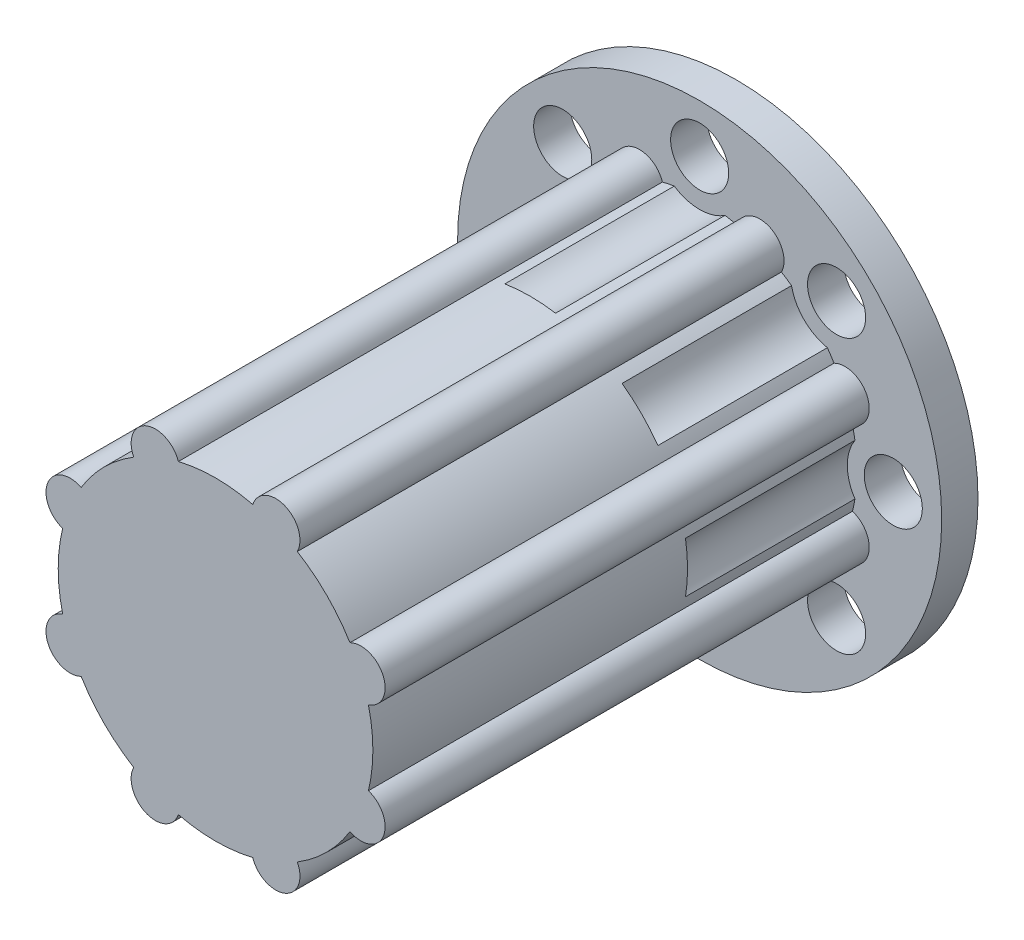
from build123d import *

# Parameters (mm, degrees)
CROQUIS1_R              = 10
CROQUIS1_R_2            = 5
SALIENTE_EXTRUIR1_DEPTH = 1.5
CORTAR_EXTRUIR1_REACH   = 26.15
CROQUIS2_R              = 1.2
SALIENTE_EXTRUIR2_START = 20
CROQUIS3_R              = 6.5
CROQUIS3_R_2            = 5
SALIENTE_EXTRUIR2_DEPTH = 20
CROQUIS5_R              = 1
SALIENTE_EXTRUIR3_DEPTH = 20
CROQUIS7_R              = 1.9
CORTAR_EXTRUIR3_DEPTH   = 7
CROQUIS8_R              = 6
SALIENTE_EXTRUIR4_DEPTH = 15


with BuildPart() as part:
    # Croquis1 → Saliente-Extruir1 (new body)
    with BuildSketch(Plane.XY):
        with Locations((1.467948917, 11.200668728)):
            Circle(CROQUIS1_R)
        with Locations((1.467948917, 11.200668728)):
            Circle(CROQUIS1_R_2, mode=Mode.SUBTRACT)
    extrude(amount=-SALIENTE_EXTRUIR1_DEPTH)

    # Croquis2 → Cortar-Extruir1 (cut, up to next)
    with BuildSketch(Plane.XY, mode=Mode.PRIVATE) as cortar_extruir1_sk1:
        with Locations((1.467948917, 19.200668728)):
            Circle(CROQUIS2_R)
    cortar_extruir1_tool1 = extrude(cortar_extruir1_sk1.sketch, amount=-CORTAR_EXTRUIR1_REACH, mode=Mode.PRIVATE) & part.part
    # Croquis2 → Cortar-Extruir1 (cut, up to next)
    with BuildSketch(Plane.XY, mode=Mode.PRIVATE) as cortar_extruir1_sk2:
        with Locations((7.124803167, 16.857522978)):
            Circle(CROQUIS2_R)
    cortar_extruir1_tool2 = extrude(cortar_extruir1_sk2.sketch, amount=-CORTAR_EXTRUIR1_REACH, mode=Mode.PRIVATE) & part.part
    # Croquis2 → Cortar-Extruir1 (cut, up to next)
    with BuildSketch(Plane.XY, mode=Mode.PRIVATE) as cortar_extruir1_sk3:
        with Locations((9.467948917, 11.200668728)):
            Circle(CROQUIS2_R)
    cortar_extruir1_tool3 = extrude(cortar_extruir1_sk3.sketch, amount=-CORTAR_EXTRUIR1_REACH, mode=Mode.PRIVATE) & part.part
    # Croquis2 → Cortar-Extruir1 (cut, up to next)
    with BuildSketch(Plane.XY, mode=Mode.PRIVATE) as cortar_extruir1_sk4:
        with Locations((7.124803167, 5.543814479)):
            Circle(CROQUIS2_R)
    cortar_extruir1_tool4 = extrude(cortar_extruir1_sk4.sketch, amount=-CORTAR_EXTRUIR1_REACH, mode=Mode.PRIVATE) & part.part
    # Croquis2 → Cortar-Extruir1 (cut, up to next)
    with BuildSketch(Plane.XY, mode=Mode.PRIVATE) as cortar_extruir1_sk5:
        with Locations((1.467948917, 3.200668728)):
            Circle(CROQUIS2_R)
    cortar_extruir1_tool5 = extrude(cortar_extruir1_sk5.sketch, amount=-CORTAR_EXTRUIR1_REACH, mode=Mode.PRIVATE) & part.part
    # Croquis2 → Cortar-Extruir1 (cut, up to next)
    with BuildSketch(Plane.XY, mode=Mode.PRIVATE) as cortar_extruir1_sk6:
        with Locations((-4.188905332, 5.543814479)):
            Circle(CROQUIS2_R)
    cortar_extruir1_tool6 = extrude(cortar_extruir1_sk6.sketch, amount=-CORTAR_EXTRUIR1_REACH, mode=Mode.PRIVATE) & part.part
    # Croquis2 → Cortar-Extruir1 (cut, up to next)
    with BuildSketch(Plane.XY, mode=Mode.PRIVATE) as cortar_extruir1_sk7:
        with Locations((-6.532051083, 11.200668728)):
            Circle(CROQUIS2_R)
    cortar_extruir1_tool7 = extrude(cortar_extruir1_sk7.sketch, amount=-CORTAR_EXTRUIR1_REACH, mode=Mode.PRIVATE) & part.part
    # Croquis2 → Cortar-Extruir1 (cut, up to next)
    with BuildSketch(Plane.XY, mode=Mode.PRIVATE) as cortar_extruir1_sk8:
        with Locations((-4.188905332, 16.857522978)):
            Circle(CROQUIS2_R)
    cortar_extruir1_tool8 = extrude(cortar_extruir1_sk8.sketch, amount=-CORTAR_EXTRUIR1_REACH, mode=Mode.PRIVATE) & part.part
    add(cortar_extruir1_tool1.solids().sort_by_distance((1.467949, 19.200669, 0))[0], mode=Mode.SUBTRACT)
    add(cortar_extruir1_tool2.solids().sort_by_distance((7.124803, 16.857523, 0))[0], mode=Mode.SUBTRACT)
    add(cortar_extruir1_tool3.solids().sort_by_distance((9.467949, 11.200669, 0))[0], mode=Mode.SUBTRACT)
    add(cortar_extruir1_tool4.solids().sort_by_distance((7.124803, 5.543814, 0))[0], mode=Mode.SUBTRACT)
    add(cortar_extruir1_tool5.solids().sort_by_distance((1.467949, 3.200669, 0))[0], mode=Mode.SUBTRACT)
    add(cortar_extruir1_tool6.solids().sort_by_distance((-4.188905, 5.543814, 0))[0], mode=Mode.SUBTRACT)
    add(cortar_extruir1_tool7.solids().sort_by_distance((-6.532051, 11.200669, 0))[0], mode=Mode.SUBTRACT)
    add(cortar_extruir1_tool8.solids().sort_by_distance((-4.188905, 16.857523, 0))[0], mode=Mode.SUBTRACT)

    # Croquis3 → Saliente-Extruir2 (add)
    with BuildSketch(Plane.XY.offset(SALIENTE_EXTRUIR2_START)):
        with Locations((1.467948917, 11.200668728)):
            Circle(CROQUIS3_R)
        with Locations((1.467948917, 11.200668728)):
            Circle(CROQUIS3_R_2, mode=Mode.SUBTRACT)
    extrude(amount=-SALIENTE_EXTRUIR2_DEPTH)

    # Croquis5 → Saliente-Extruir3 (add)
    with BuildSketch(Plane.XY.offset(20)):
        with Locations((3.955391227, 17.20588569)):
            Circle(CROQUIS5_R)
        with Locations((7.473165878, 13.688111039)):
            Circle(CROQUIS5_R)
        with Locations((7.473165878, 8.713226418)):
            Circle(CROQUIS5_R)
        with Locations((3.955391227, 5.195451767)):
            Circle(CROQUIS5_R)
        with Locations((-1.019493393, 5.195451767)):
            Circle(CROQUIS5_R)
        with Locations((-4.537268044, 8.713226418)):
            Circle(CROQUIS5_R)
        with Locations((-4.537268044, 13.688111039)):
            Circle(CROQUIS5_R)
        with Locations((-1.019493393, 17.20588569)):
            Circle(CROQUIS5_R)
    extrude(amount=-SALIENTE_EXTRUIR3_DEPTH)

    # Croquis7 → Cortar-Extruir3 (cut)
    with BuildSketch(Plane.XY):
        with Locations((-4.188905332, 16.857522978)):
            Circle(CROQUIS7_R)
        with Locations((1.467948917, 19.200668728)):
            Circle(CROQUIS7_R)
        with Locations((7.124803167, 16.857522978)):
            Circle(CROQUIS7_R)
        with Locations((9.467948917, 11.200668728)):
            Circle(CROQUIS7_R)
        with Locations((7.124803167, 5.543814479)):
            Circle(CROQUIS7_R)
        with Locations((1.467948917, 3.200668728)):
            Circle(CROQUIS7_R)
        with Locations((-4.188905332, 5.543814479)):
            Circle(CROQUIS7_R)
        with Locations((-6.532051083, 11.200668728)):
            Circle(CROQUIS7_R)
    extrude(amount=CORTAR_EXTRUIR3_DEPTH, mode=Mode.SUBTRACT)

    # Croquis8 → Saliente-Extruir4 (add)
    with BuildSketch(Plane.XY.offset(20)):
        with Locations((1.467948917, 11.200668728)):
            Circle(CROQUIS8_R)
    extrude(amount=-SALIENTE_EXTRUIR4_DEPTH)


solid = part.part
